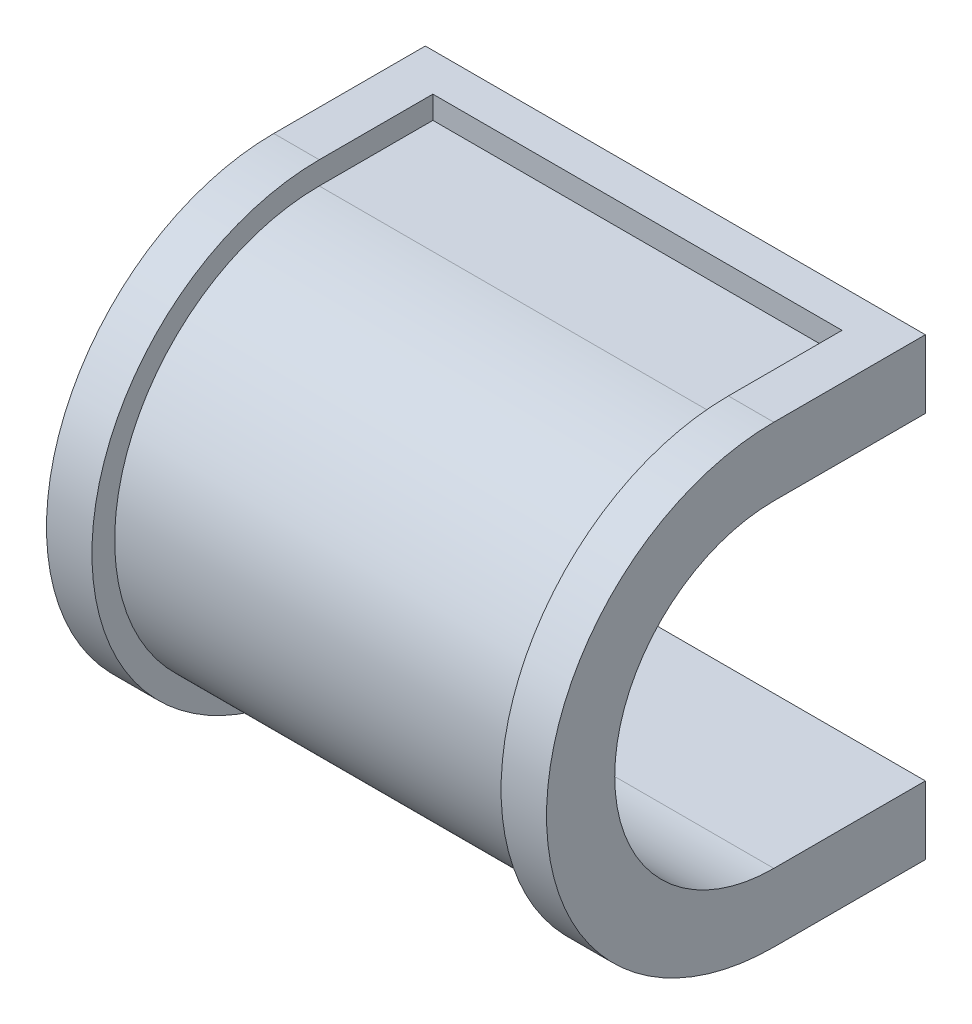
from build123d import *

# Parameters (mm, degrees)
BOSS_EXTRUDE1_DEPTH = 66
CUT_EXTRUDE1_DEPTH  = 92.290744328
BOSS_EXTRUDE2_START = -6
BOSS_EXTRUDE2_DEPTH = 6
BOSS_EXTRUDE3_DEPTH = 6


with BuildPart() as part:
    # Sketch1 → Boss-Extrude1 (new body)
    with BuildSketch(Plane.YZ):
        with BuildLine():
            Line((0, 0), (0, -15))
            Line((0, -15), (-3, -15))
            Line((-3, -15), (-3, -20))
            Line((-3, -20), (0, -20))
            Line((0, -20), (54, -20))
            Line((54, -20), (57, -20))
            Line((57, -20), (57, -15))
            Line((57, -15), (54, -15))
            Line((54, -15), (54, 0))
            ThreePointArc((54, 0), (27, 27), (0, 0))
        make_face()
    extrude(amount=BOSS_EXTRUDE1_DEPTH)

    # Sketch2 → Cut-Extrude1 (cut, through all)
    with BuildSketch(Plane.YZ.offset(66)):
        with BuildLine():
            Line((6, 0), (6, -20))
            Line((6, -20), (48, -20))
            Line((48, -20), (48, 0))
            ThreePointArc((48, 0), (27, 21), (6, 0))
        make_face()
    extrude(amount=-CUT_EXTRUDE1_DEPTH, mode=Mode.SUBTRACT)

    # Sketch3 → Boss-Extrude2 (add)
    with BuildSketch(Plane.YZ.offset(66).offset(BOSS_EXTRUDE2_START)):
        with BuildLine():
            Line((-3, -15), (0, -15))
            Line((0, -15), (0, 0))
            ThreePointArc((0, 0), (27, 27), (54, 0))
            Line((54, 0), (54, -15))
            Line((54, -15), (57, -15))
            Line((57, -15), (57, 0))
            ThreePointArc((57, 0), (27, 30), (-3, 0))
            Line((-3, 0), (-3, -15))
        make_face()
    extrude(amount=BOSS_EXTRUDE2_DEPTH)

    # Sketch4 → Boss-Extrude3 (add)
    with BuildSketch(Plane(origin=(0, 0, 0), x_dir=(0, -1, 0), z_dir=(-1, 0, 0))):
        with BuildLine():
            Line((-54, -15), (-57, -15))
            Line((-57, -15), (-57, 0))
            ThreePointArc((-57, 0), (-27, 30), (3, 0))
            Line((3, 0), (3, -15))
            Line((3, -15), (0, -15))
            Line((0, -15), (0, 0))
            ThreePointArc((0, 0), (-27, 27), (-54, 0))
            Line((-54, 0), (-54, -15))
        make_face()
    extrude(amount=-BOSS_EXTRUDE3_DEPTH)


solid = part.part
